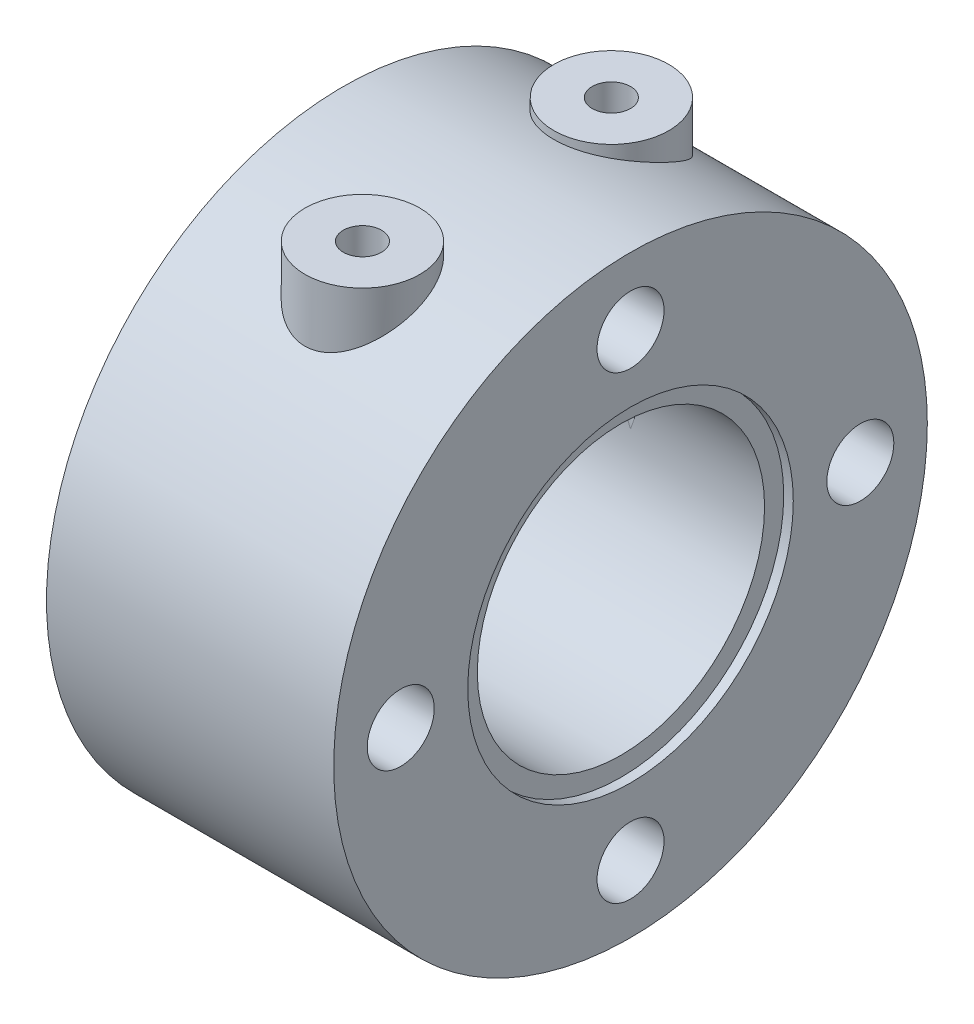
from build123d import *

# Parameters (mm, degrees)
SKETCH2_R                = 15.5
SKETCH2_R_2              = 1.75
SKETCH2_R_3              = 7.5
FLANGE_DEPTH             = 15
SKETCH3_R                = 8.5
O_RING_SEAT_DEPTH        = 0.5
SKETCH5_R                = 1
OUTLET_DEPTH             = 27.561249971
BOSS_EXTRUDE2_REACH      = 39.766
BOSS_EXTRUDE2_END_RADIUS = 15.5
SKETCH6_R                = 3
SKETCH6_R_2              = 1


with BuildPart() as part:
    # Sketch2 → Flange (new body)
    with BuildSketch(Plane(origin=(0, 0, 0), x_dir=(0, 0, -1), z_dir=(1, 0, 0))):
        Circle(SKETCH2_R)
        with Locations((0, 12)):
            Circle(SKETCH2_R_2, mode=Mode.SUBTRACT)
        with Locations((12, 0)):
            Circle(SKETCH2_R_2, mode=Mode.SUBTRACT)
        with Locations((0, -12)):
            Circle(SKETCH2_R_2, mode=Mode.SUBTRACT)
        with Locations((-12, 0)):
            Circle(SKETCH2_R_2, mode=Mode.SUBTRACT)
        Circle(SKETCH2_R_3, mode=Mode.SUBTRACT)
    extrude(amount=FLANGE_DEPTH)

    # Sketch3 → O-Ring Seat (cut)
    with BuildSketch(Plane(origin=(15, 0, 0), x_dir=(0, 0, -1), z_dir=(1, 0, 0))):
        Circle(SKETCH3_R)
    o_ring_seat = extrude(amount=-O_RING_SEAT_DEPTH, mode=Mode.SUBTRACT)

    # Mirror1: O-Ring Seat across plane
    add(o_ring_seat.mirror(Plane.ZY.offset(-7.5)), mode=Mode.SUBTRACT)

    # Sketch5 → Outlet (cut, through all)
    with BuildSketch(Plane(origin=(0, 0, 0), x_dir=(1, 0, 0), z_dir=(0, 1, 0))):
        with Locations(Location((7.5, 6.5, 0), (0, 0, 90))):
            Circle(SKETCH5_R)
    outlet = extrude(amount=OUTLET_DEPTH, mode=Mode.SUBTRACT)

    # Boss-Extrude2: up to this cylinder (the profile starts outside it)
    boss_extrude2_end = Plane(origin=(7.5, 0, 0), z_dir=(-1, 0, 0)) * Cylinder(BOSS_EXTRUDE2_END_RADIUS, 111.532, mode=Mode.PRIVATE)
    # Sketch6 → Boss-Extrude2 (add, up to the surface)
    with BuildSketch(Plane(origin=(0, 15.5, 0), x_dir=(1, 0, 0), z_dir=(0, 1, 0)), mode=Mode.PRIVATE) as boss_extrude2_sk1:
        with Locations(Location((7.5, 6.5, 0), (0, 0, 270))):
            Circle(SKETCH6_R)
        with Locations(Location((7.5, 6.5, 0), (0, 0, 90))):
            Circle(SKETCH6_R_2, mode=Mode.SUBTRACT)
    boss_extrude2_tool1 = extrude(boss_extrude2_sk1.sketch, amount=-BOSS_EXTRUDE2_REACH, mode=Mode.PRIVATE) - boss_extrude2_end
    boss_extrude2 = boss_extrude2_tool1.solids().sort_by_distance((7.5, 15.5, -9.415147))[0]
    add(boss_extrude2)

    # Inlet: Outlet, Boss-Extrude2 across plane
    add(outlet.mirror(Plane.XY), mode=Mode.SUBTRACT)
    add(boss_extrude2.mirror(Plane.XY))


solid = part.part
